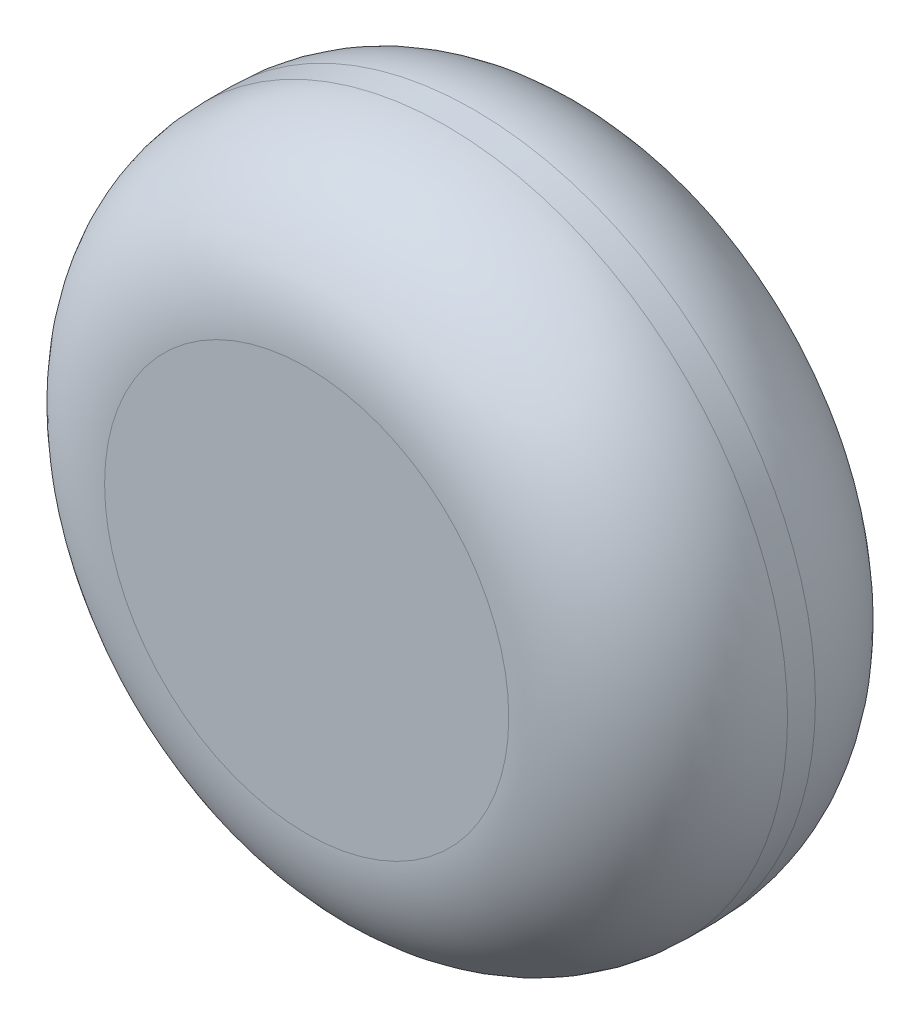
from build123d import *

# Parameters (mm, degrees)
ESQUISSE1_R      = 12.25
EXTRUSION1_DEPTH = 11
CONG_1_R         = 5


with BuildPart() as part:
    # Esquisse1 → Extrusion1 (new body)
    with BuildSketch(Plane.XY):
        Circle(ESQUISSE1_R)
    extrude(amount=EXTRUSION1_DEPTH)

    # Congé1
    cong_1_edges = [part.edges().sort_by_distance(p)[0] for p in [
        (-12.25, 0, 0),
        (-12.25, 0, 11),
    ]]
    fillet(cong_1_edges, radius=CONG_1_R)


solid = part.part
